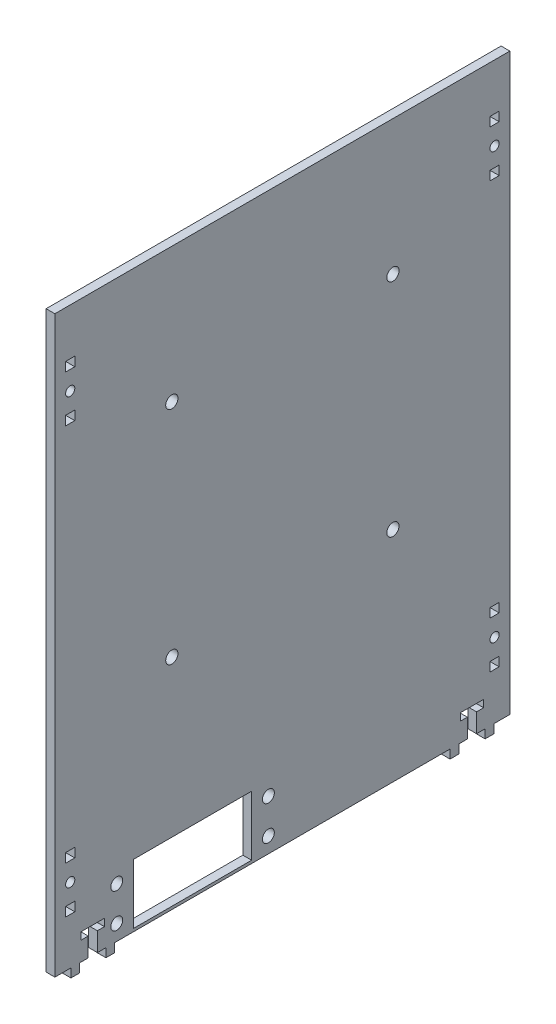
from build123d import *

# Parameters (mm, degrees)
BOSS_EXTRUDE2_DEPTH      = 1.5
BOSS_EXTRUDE2_DEPTH_BACK = 1.5
SKETCH1_R                = 1.575
SKETCH1_R_2              = 2.05
SKETCH1_R_3              = 2.1
SKETCH1_W                = 40.5
SKETCH1_H                = 20.499999995
SKETCH1_W_2              = 3.15
SKETCH1_H_2              = 3.15


with BuildPart() as part:
    # Sketch1 → Boss-Extrude2 (new, two sides: drawn at the far end of the back side and taken through both)
    with BuildSketch(Plane(origin=(0, 0, 0), x_dir=(0, 0, -1), z_dir=(1, 0, 0)).offset(-BOSS_EXTRUDE2_DEPTH_BACK)):
        Polygon((11.425, 0), (8.5, 0), (8.5, -3), (5.5, -3), (5.5, 0), (0, 0), (0, 197), (156, 197), (156, 0), (150.5, 0), (150.5, -3), (147.5, -3), (147.5, 0), (144.575, 0), (144.575, 6.5), (147, 6.5), (147, 9), (139, 9), (139, 6.5), (141.425, 6.5), (141.425, 0), (138.5, 0), (138.5, -3), (135.5, -3), (135.5, 0), (20.5, 0), (20.5, -3), (17.5, -3), (17.5, 0), (14.575, 0), (14.575, 6.5), (17, 6.5), (17, 9), (9, 9), (9, 6.5), (11.425, 6.5), align=None)
        with Locations((5.25, 25.575)):
            Circle(SKETCH1_R, mode=Mode.SUBTRACT)
        with Locations((5.25, 171.425)):
            Circle(SKETCH1_R, mode=Mode.SUBTRACT)
        with Locations((150.75, 171.425)):
            Circle(SKETCH1_R, mode=Mode.SUBTRACT)
        with Locations((150.75, 25.575)):
            Circle(SKETCH1_R, mode=Mode.SUBTRACT)
        with Locations((73.2, 5.35)):
            Circle(SKETCH1_R_2, mode=Mode.SUBTRACT)
        with Locations((73.2, 17.149999995)):
            Circle(SKETCH1_R_2, mode=Mode.SUBTRACT)
        with Locations((21.2, 5.35)):
            Circle(SKETCH1_R_2, mode=Mode.SUBTRACT)
        with Locations((21.2, 17.149999995)):
            Circle(SKETCH1_R_2, mode=Mode.SUBTRACT)
        with Locations((40.1, 75)):
            Circle(SKETCH1_R_3, mode=Mode.SUBTRACT)
        with Locations((40.1, 150.8)):
            Circle(SKETCH1_R_3, mode=Mode.SUBTRACT)
        with Locations((115.9, 75)):
            Circle(SKETCH1_R_3, mode=Mode.SUBTRACT)
        with Locations((115.9, 150.8)):
            Circle(SKETCH1_R_3, mode=Mode.SUBTRACT)
        with Locations((47.2, 11.249999997)):
            Rectangle(SKETCH1_W, SKETCH1_H, mode=Mode.SUBTRACT)
        with Locations((5.25, 17.575)):
            Rectangle(SKETCH1_W_2, SKETCH1_H_2, mode=Mode.SUBTRACT)
        with Locations((5.25, 33.575)):
            Rectangle(SKETCH1_W_2, SKETCH1_H_2, mode=Mode.SUBTRACT)
        with Locations((5.25, 163.425)):
            Rectangle(SKETCH1_W_2, SKETCH1_H_2, mode=Mode.SUBTRACT)
        with Locations((5.25, 179.425)):
            Rectangle(SKETCH1_W_2, SKETCH1_H_2, mode=Mode.SUBTRACT)
        with Locations((150.75, 179.425)):
            Rectangle(SKETCH1_W_2, SKETCH1_H_2, mode=Mode.SUBTRACT)
        with Locations((150.75, 163.425)):
            Rectangle(SKETCH1_W_2, SKETCH1_H_2, mode=Mode.SUBTRACT)
        with Locations((150.75, 33.575)):
            Rectangle(SKETCH1_W_2, SKETCH1_H_2, mode=Mode.SUBTRACT)
        with Locations((150.75, 17.575)):
            Rectangle(SKETCH1_W_2, SKETCH1_H_2, mode=Mode.SUBTRACT)
    extrude(amount=BOSS_EXTRUDE2_DEPTH + BOSS_EXTRUDE2_DEPTH_BACK)


solid = part.part
